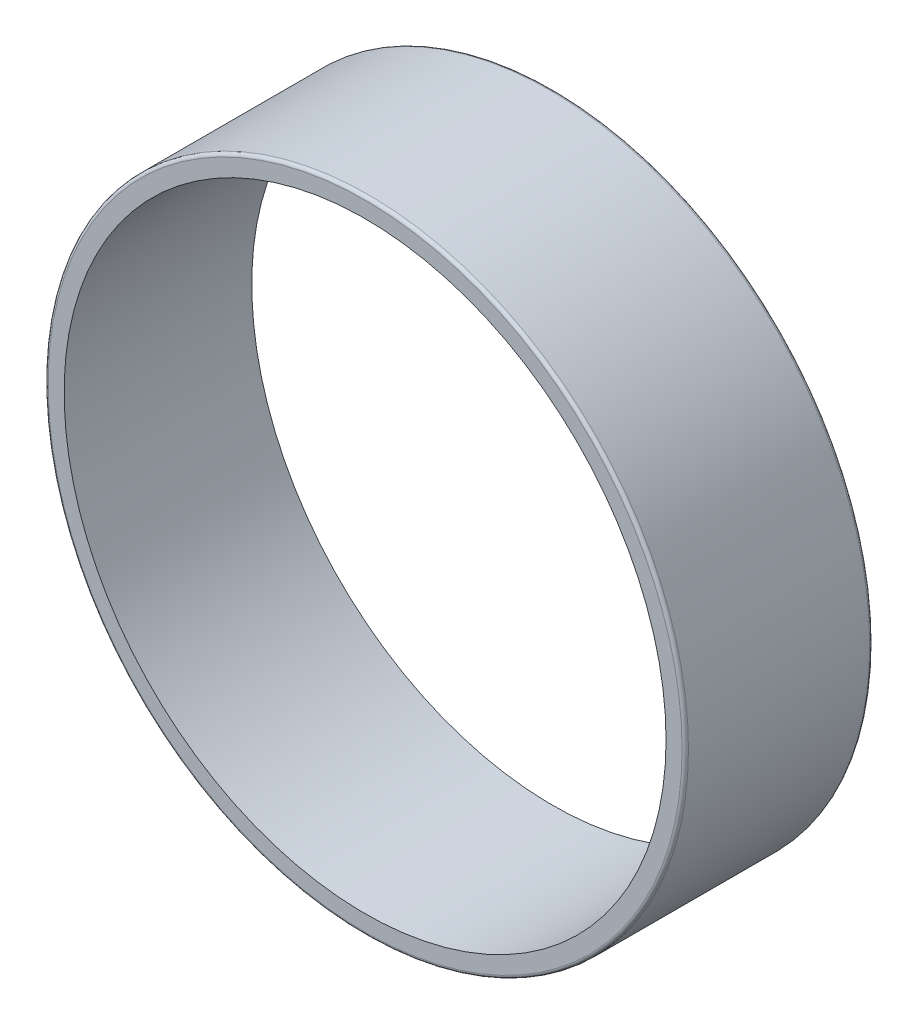
from build123d import *

# Parameters (mm, degrees)
ESQUISSE1_R        = 50
ESQUISSE1_R_2      = 47
BOSS_EXTRU_1_DEPTH = 29.3
CONG_1_R           = 0.5


with BuildPart() as part:
    # Esquisse1 → Boss.-Extru.1 (new body)
    with BuildSketch(Plane.XY):
        Circle(ESQUISSE1_R)
        Circle(ESQUISSE1_R_2, mode=Mode.SUBTRACT)
    extrude(amount=BOSS_EXTRU_1_DEPTH)

    # Congé1
    cong_1_edges = [part.edges().sort_by_distance(p)[0] for p in [
        (-50, 0, 0),
        (-50, 0, 29.3),
    ]]
    fillet(cong_1_edges, radius=CONG_1_R)


solid = part.part
